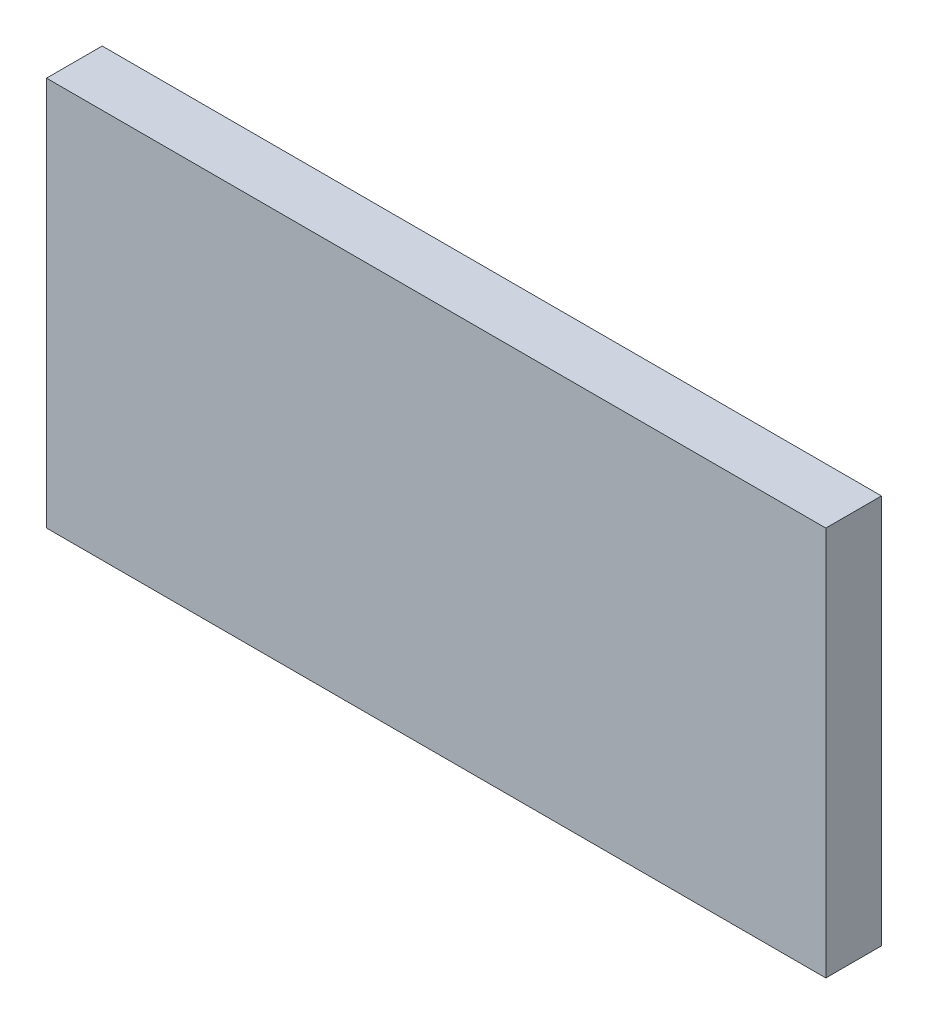
from build123d import *

# Parameters (mm, degrees)
SKETCH1_W           = 280
SKETCH1_H           = 140
BOSS_EXTRUDE1_DEPTH = 20


with BuildPart() as part:
    # Sketch1 → Boss-Extrude1 (new body)
    with BuildSketch(Plane.XY):
        Rectangle(SKETCH1_W, SKETCH1_H)
    extrude(amount=BOSS_EXTRUDE1_DEPTH)


solid = part.part
